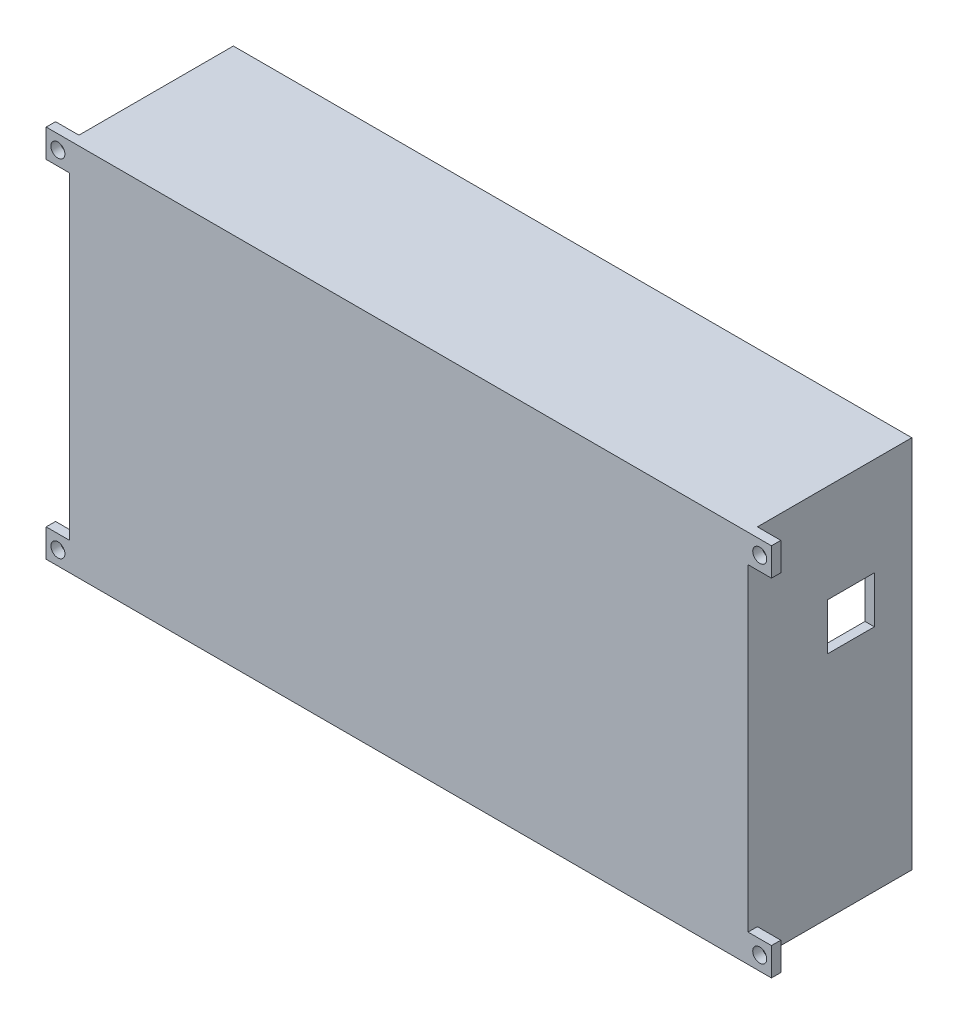
from build123d import *

# Parameters (mm, degrees)
SKETCH_1_W                       = 145
SKETCH_1_H                       = 80
EXTRUDE_1_DEPTH                  = 35
SKETCH_2_W                       = 141
SKETCH_2_H                       = 76
CUT_EXTRUDE_1_DEPTH              = 33
SKETCH_3_R                       = 3.5
EXTRUDE_2_DEPTH                  = 15
SKETCH_4_R                       = 1.5
CUT_EXTRUDE_2_DEPTH              = 15
SKETCH_5_W                       = 10
SKETCH_5_H                       = 10
SKETCH_5_W_2                     = 16
SKETCH_5_H_2                     = 21
CUT_EXTRUDE_3_DEPTH              = 15
SKETCH_6_W                       = 10
SKETCH_6_H                       = 10
CUT_EXTRUDE_4_DEPTH              = 15
SKETCH_9_R                       = 3.5
EXTRUDE_3_DEPTH                  = 33
SKETCH_10_R                      = 1.5
CUT_EXTRUDE_5_DEPTH              = 33
PATTERN_LINEAR_2_COUNT           = 2
PATTERN_LINEAR_2_PITCH           = 72
PATTERN_LINEAR_2_COUNT_DIR2      = 2
PATTERN_LINEAR_2_PITCH_DIR2      = 137
SKETCH_12_W                      = 2
SKETCH_12_H                      = 6
EXTRUDE_4_DEPTH                  = 5
SKETCH_13_R                      = 1.5
CUT_EXTRUDE_6_DEPTH              = 5
PATTERN_LINEAR_3_COUNT           = 2
PATTERN_LINEAR_3_PITCH           = 74
PATTERN_LINEAR_4_COUNT           = 2
PATTERN_LINEAR_4_PITCH           = 150
PATTERN_LINEAR_4_COPY_1_SKETCH_R = 1.5
PATTERN_LINEAR_4_COPY_1_DEPTH    = 5


with BuildPart() as part:
    # Эскиз1 → Бобышка-Вытянуть1 (new body)
    with BuildSketch(Plane.XY):
        with Locations((72.5, 40)):
            Rectangle(SKETCH_1_W, SKETCH_1_H)
    extrude(amount=EXTRUDE_1_DEPTH)

    # Эскиз2 → Вырез-Вытянуть1 (cut)
    with BuildSketch(Plane(origin=(0, 0, 0), x_dir=(-1, 0, 0), z_dir=(0, 0, -1))):
        with Locations((-72.5, 40)):
            Rectangle(SKETCH_2_W, SKETCH_2_H)
    extrude(amount=-CUT_EXTRUDE_1_DEPTH, mode=Mode.SUBTRACT)

    # Эскиз3 → Бобышка-Вытянуть2 (add)
    with BuildSketch(Plane(origin=(0, 0, 33), x_dir=(-1, 0, 0), z_dir=(0, 0, -1))):
        with Locations(Location((-109.79, 62.86, 0), (0, 0, 180))):
            Circle(SKETCH_3_R)
        with Locations(Location((-109.79, 17.14, 0), (0, 0, 180))):
            Circle(SKETCH_3_R)
        with Locations(Location((-34.79, 64.13, 0), (0, 0, 180))):
            Circle(SKETCH_3_R)
        with Locations(Location((-34.79, 15.87, 0), (0, 0, 180))):
            Circle(SKETCH_3_R)
    extrude(amount=EXTRUDE_2_DEPTH)

    # Эскиз4 → Вырез-Вытянуть2 (cut)
    with BuildSketch(Plane(origin=(0, 0, 18), x_dir=(-1, 0, 0), z_dir=(0, 0, -1))):
        with Locations((-109.79, 62.86)):
            Circle(SKETCH_4_R)
        with Locations((-34.79, 64.13)):
            Circle(SKETCH_4_R)
        with Locations((-34.79, 15.87)):
            Circle(SKETCH_4_R)
        with Locations((-109.79, 17.14)):
            Circle(SKETCH_4_R)
    extrude(amount=-CUT_EXTRUDE_2_DEPTH, mode=Mode.SUBTRACT)

    # Эскиз5 → Вырез-Вытянуть3 (cut)
    with BuildSketch(Plane.ZY):
        with Locations((13, 26)):
            Rectangle(SKETCH_5_W, SKETCH_5_H)
        with Locations((14, 51.5)):
            Rectangle(SKETCH_5_W_2, SKETCH_5_H_2)
    extrude(amount=-CUT_EXTRUDE_3_DEPTH, mode=Mode.SUBTRACT)

    # Эскиз6 → Вырез-Вытянуть4 (cut)
    with BuildSketch(Plane.ZY.offset(-143)):
        with Locations((13, 54)):
            Rectangle(SKETCH_6_W, SKETCH_6_H)
    extrude(amount=-CUT_EXTRUDE_4_DEPTH, mode=Mode.SUBTRACT)

    # Эскиз9 → Бобышка-Вытянуть3 (add)
    with BuildSketch(Plane(origin=(0, 0, 33), x_dir=(-1, 0, 0), z_dir=(0, 0, -1))):
        with Locations((-4, 76)):
            Circle(SKETCH_9_R)
    extrude_3 = extrude(amount=EXTRUDE_3_DEPTH)

    # Эскиз10 → Вырез-Вытянуть5 (cut)
    with BuildSketch(Plane(origin=(0, 0, 0), x_dir=(-1, 0, 0), z_dir=(0, 0, -1))):
        with Locations((-4, 76)):
            Circle(SKETCH_10_R)
    cut_extrude_5 = extrude(amount=-CUT_EXTRUDE_5_DEPTH, mode=Mode.SUBTRACT)

    # Линейный массив2: Бобышка-Вытянуть3, Cut-Extrude 5 2 × 2
    with Locations(*[(j * PATTERN_LINEAR_2_PITCH_DIR2, -i * PATTERN_LINEAR_2_PITCH, 0) for i in range(PATTERN_LINEAR_2_COUNT) for j in range(PATTERN_LINEAR_2_COUNT_DIR2) if (i, j) != (0, 0)]):
        add(extrude_3)
        add(cut_extrude_5, mode=Mode.SUBTRACT)

    # Эскиз12 → Бобышка-Вытянуть4 (add)
    with BuildSketch(Plane(origin=(145, 0, 0), x_dir=(0, 0, -1), z_dir=(1, 0, 0))):
        with Locations((-34, 77)):
            Rectangle(SKETCH_12_W, SKETCH_12_H)
        with Locations((-34, 3)):
            Rectangle(SKETCH_12_W, SKETCH_12_H)
    extrude_4 = extrude(amount=EXTRUDE_4_DEPTH)

    # Эскиз13 → Вырез-Вытянуть6 (cut)
    with BuildSketch(Plane(origin=(0, 0, 33), x_dir=(-1, 0, 0), z_dir=(0, 0, -1))):
        with Locations((-147.5, 77)):
            Circle(SKETCH_13_R)
    cut_extrude_6 = extrude(amount=-CUT_EXTRUDE_6_DEPTH, mode=Mode.SUBTRACT)

    # Линейный массив3: Вырез-Вытянуть6 ×2
    with Locations(*[(0, -i * PATTERN_LINEAR_3_PITCH, 0) for i in range(1, PATTERN_LINEAR_3_COUNT)]):
        add(cut_extrude_6, mode=Mode.SUBTRACT)

    # Линейный массив4: Бобышка-Вытянуть4, Вырез-Вытянуть6 ×2
    with Locations(*[(-i * PATTERN_LINEAR_4_PITCH, 0, 0) for i in range(1, PATTERN_LINEAR_4_COUNT)]):
        add(extrude_4)
        add(cut_extrude_6, mode=Mode.SUBTRACT)

    # Линейный массив4 copy 1 sketch → Линейный массив4 copy 1 (cut)
    with BuildSketch(Plane(origin=(-150, -74, 33), x_dir=(-1, 0, 0), z_dir=(0, 0, -1))):
        with Locations((-147.5, 77)):
            Circle(PATTERN_LINEAR_4_COPY_1_SKETCH_R)
    extrude(amount=-PATTERN_LINEAR_4_COPY_1_DEPTH, mode=Mode.SUBTRACT)


solid = part.part
